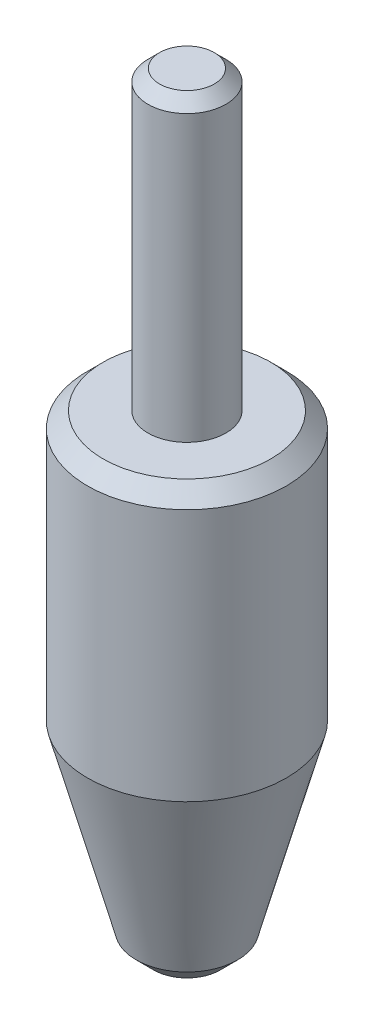
from build123d import *

# Parameters (mm, degrees)
CHAMFER1_SIZE = 0.15
CHAMFER2_SIZE = 0.2


with BuildPart() as part:
    # Sketch1 → Base-Revolve (revolve)
    with BuildSketch(Plane.XY, mode=Mode.PRIVATE) as base_revolve_sk:
        with BuildLine():
            Line((0, 10), (-0.5, 10))
            Line((-0.5, 10), (-0.5, 6.2))
            Line((-0.5, 6.2), (-1.275, 6.2))
            Line((-1.275, 6.2), (-1.275, 2.757531755))
            Line((-1.275, 2.757531755), (-0.65, 0.425))
            Line((-0.65, 0.425), (-0.425, 0.2))
            Line((-0.425, 0.2), (-0.346410162, 0.2))
            ThreePointArc((-0.346410162, 0.2), (-0.2, 0.053589838), (0, 0))
            Line((0, 0), (0, 10))
        make_face()
    revolve(base_revolve_sk.sketch.rotate(Axis((0, -4.076789028, 0), (0, 1, 0)), 180), axis=Axis((0, -4.076789028, 0), (0, 1, 0)))

    # Chamfer1
    chamfer1_edges = [part.edges().sort_by_distance(p)[0] for p in [
        (-0.5, 10, 0),
    ]]
    chamfer(chamfer1_edges, length=CHAMFER1_SIZE)

    # Chamfer2
    chamfer2_edges = [part.edges().sort_by_distance(p)[0] for p in [
        (-1.275, 6.2, 0),
    ]]
    chamfer(chamfer2_edges, length=CHAMFER2_SIZE)


solid = part.part
